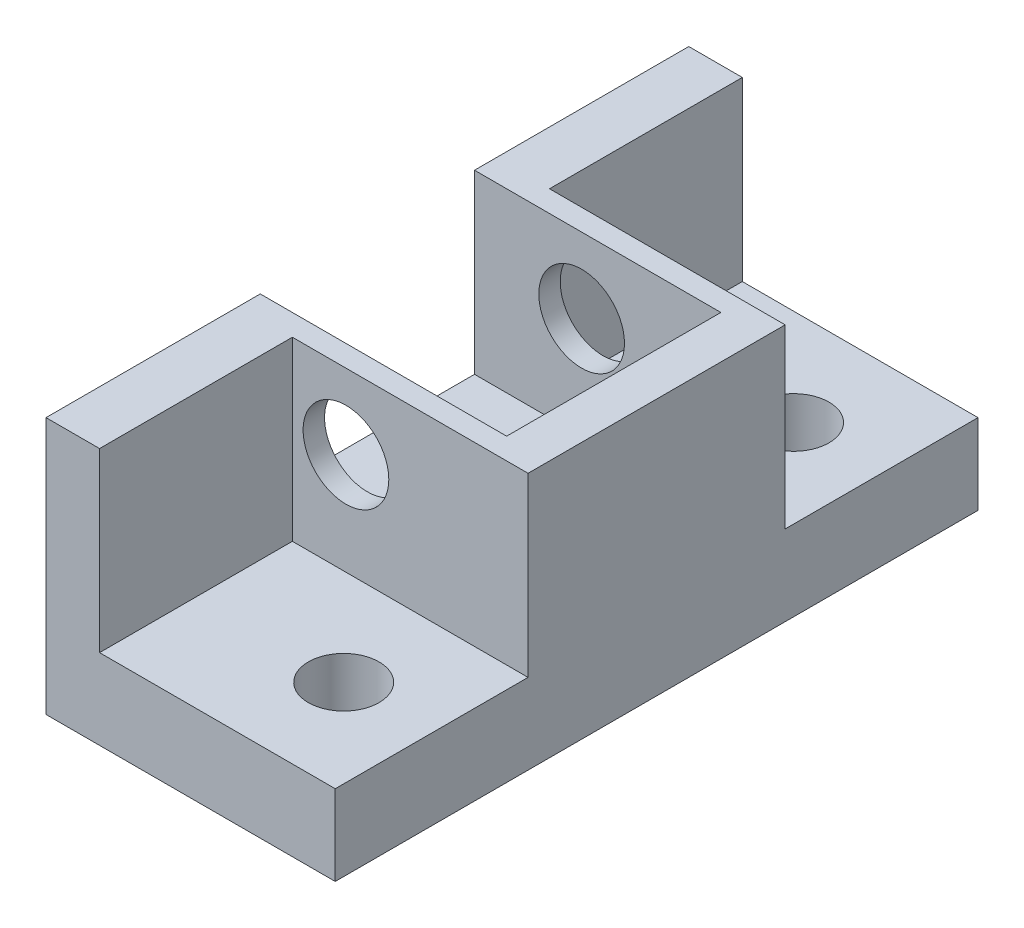
from build123d import *

# Parameters (mm, degrees)
SKETCH2_W           = 27
SKETCH2_H           = 60
BOSS_EXTRUDE1_DEPTH = 7.5
BOSS_EXTRUDE2_DEPTH = 16.5
SKETCH4_R           = 4
CUT_EXTRUDE1_DEPTH  = 51.222007128
SKETCH5_R           = 3.3
CUT_EXTRUDE2_DEPTH  = 37.803532439


with BuildPart() as part:
    # Sketch2 → Boss-Extrude1 (new body)
    with BuildSketch(Plane(origin=(0, 0, 0), x_dir=(1, 0, 0), z_dir=(0, 1, 0))):
        Rectangle(SKETCH2_W, SKETCH2_H)
    extrude(amount=BOSS_EXTRUDE1_DEPTH)

    # Sketch3 → Boss-Extrude2 (add)
    with BuildSketch(Plane(origin=(0, 7.5, 0), x_dir=(1, 0, 0), z_dir=(0, 1, 0))):
        Polygon((-13.5, -30), (-8.5, -30), (-8.5, -12), (13.5, -12), (13.5, 12), (-8.5, 12), (-8.5, 30), (-13.5, 30), (-13.5, 10), (9.5, 10), (9.5, -10), (-13.5, -10), align=None)
    extrude(amount=BOSS_EXTRUDE2_DEPTH)

    # Sketch4 → Cut-Extrude1 (cut, through all)
    with BuildSketch(Plane.XY.offset(12)):
        with Locations((-3.5, 17)):
            Circle(SKETCH4_R)
    extrude(amount=-CUT_EXTRUDE1_DEPTH, mode=Mode.SUBTRACT)

    # Sketch5 → Cut-Extrude2 (cut, through all)
    with BuildSketch(Plane(origin=(0, 7.5, 0), x_dir=(1, 0, 0), z_dir=(0, 1, 0))):
        with Locations(Location((5.287468246, -21, 0), (0, 0, 270))):
            Circle(SKETCH5_R)
        with Locations(Location((5.287468246, 21, 0), (0, 0, 90))):
            Circle(SKETCH5_R)
    extrude(amount=-CUT_EXTRUDE2_DEPTH, mode=Mode.SUBTRACT)


solid = part.part
